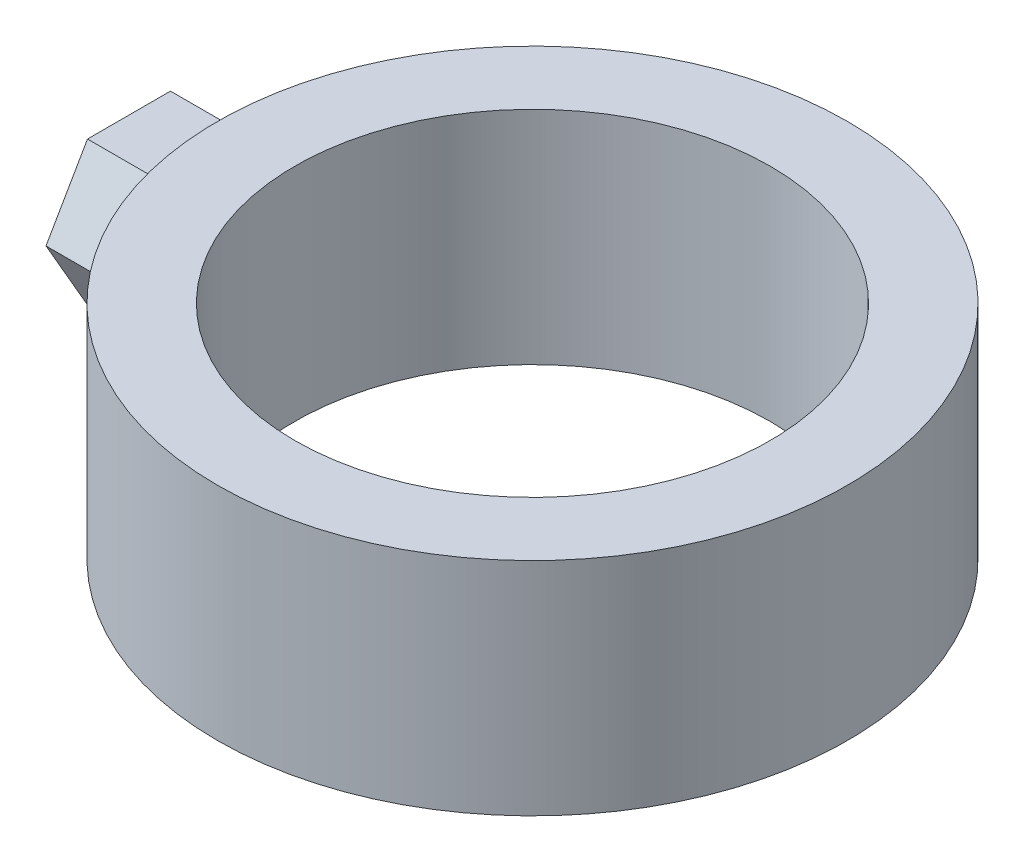
from build123d import *

# Parameters (mm, degrees)
SKETCH_2_R          = 28.5
SKETCH_2_R_2        = 21.5
EXTRUDE_1_DEPTH     = 10
EXTRUDE_START       = -25
EXTRUDE_2_DEPTH     = 11.5
SKETCH_4_R          = 4
CUT_EXTRUDE_2_DEPTH = 5


with BuildPart() as part:
    # Эскиз2 → Бобышка-Вытянуть1 (new, symmetric)
    with BuildSketch(Plane(origin=(0, 0, 0), x_dir=(1, 0, 0), z_dir=(0, 1, 0))):
        with Locations(Location((0, 0, 0), (0, 0, 270))):
            Circle(SKETCH_2_R)
        with Locations(Location((0, 0, 0), (0, 0, 270))):
            Circle(SKETCH_2_R_2, mode=Mode.SUBTRACT)
    extrude(amount=EXTRUDE_1_DEPTH, both=True)

    # Эскиз3 → Бобышка-Вытянуть2 (add)
    with BuildSketch(Plane(origin=(0, 0, 0), x_dir=(0, 0, -1), z_dir=(1, 0, 0)).offset(EXTRUDE_START)):
        Polygon((7.505553499, 0), (3.75277675, 6.5), (-3.75277675, 6.5), (-7.505553499, 0), (-3.75277675, -6.5), (3.75277675, -6.5), align=None)
    extrude(amount=-EXTRUDE_2_DEPTH)

    # Эскиз4 → Вырез-Вытянуть2 (cut)
    with BuildSketch(Plane.ZY.offset(36.5)):
        Circle(SKETCH_4_R)
    extrude(amount=-CUT_EXTRUDE_2_DEPTH, mode=Mode.SUBTRACT)


solid = part.part
